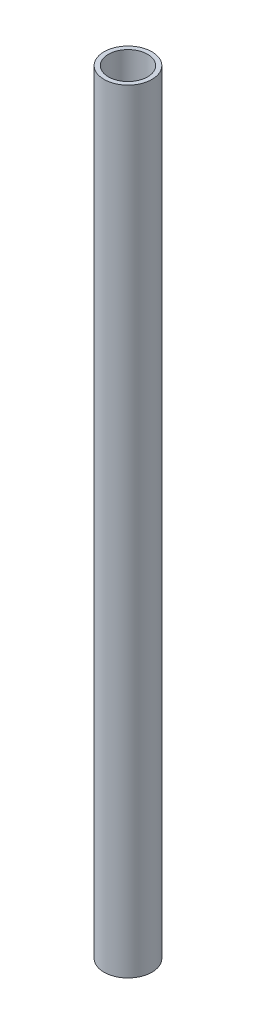
from build123d import *

# Parameters (mm, degrees)
SKETCH_1_R      = 11
SKETCH_1_R_2    = 9
EXTRUDE_1_DEPTH = 355


with BuildPart() as part:
    # Эскиз1 → Вытянуть1 (new body)
    with BuildSketch(Plane(origin=(0, 0, 0), x_dir=(1, 0, 0), z_dir=(0, 1, 0))):
        with Locations(Location((0, 0, 0), (0, 0, 270))):
            Circle(SKETCH_1_R)
        with Locations(Location((0, 0, 0), (0, 0, 270))):
            Circle(SKETCH_1_R_2, mode=Mode.SUBTRACT)
    extrude(amount=EXTRUDE_1_DEPTH)


solid = part.part
